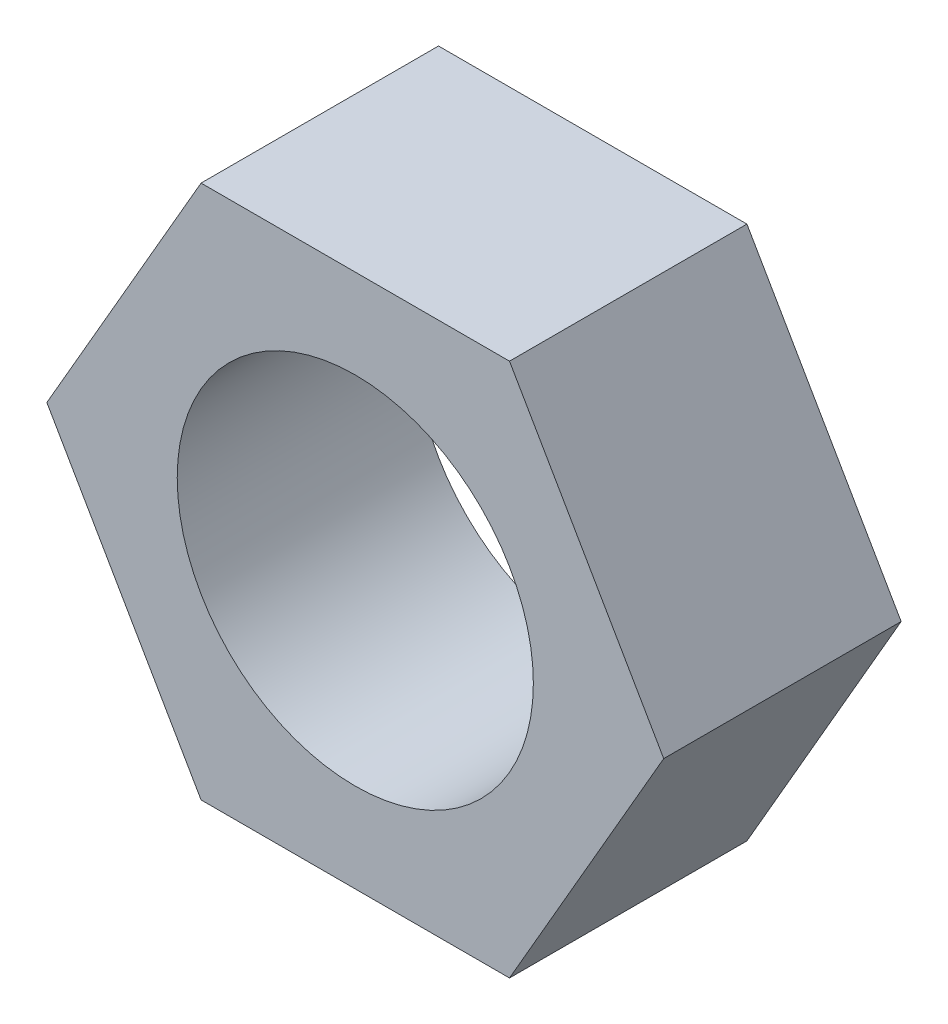
from build123d import *

# Parameters (mm, degrees)
SKETCH1_R           = 1.5
BOSS_EXTRUDE1_DEPTH = 2


with BuildPart() as part:
    # Sketch1 → Boss-Extrude1 (new body)
    with BuildSketch(Plane.XY):
        Polygon((2.598076211, 0), (1.299038106, 2.25), (-1.299038106, 2.25), (-2.598076211, 0), (-1.299038106, -2.25), (1.299038106, -2.25), align=None)
        Circle(SKETCH1_R, mode=Mode.SUBTRACT)
    extrude(amount=BOSS_EXTRUDE1_DEPTH)


solid = part.part
